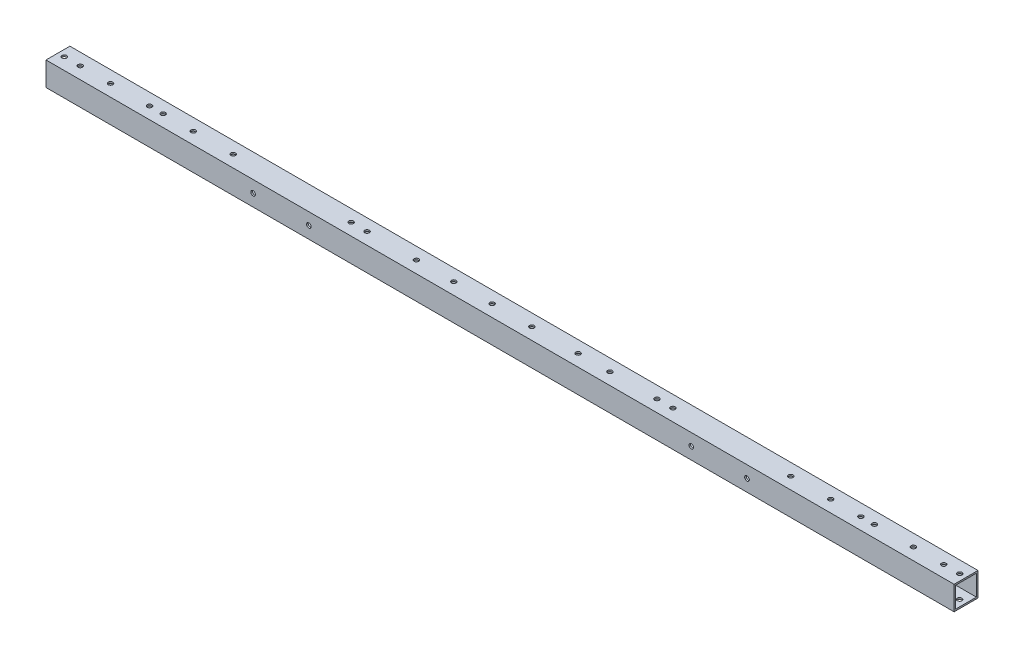
from build123d import *

# Parameters (mm, degrees)
SKETCH_1_W          = 15
SKETCH_1_H          = 15
SKETCH_1_W_2        = 13
SKETCH_1_H_2        = 13
EXTRUDE_1_DEPTH     = 570
SKETCH_2_R          = 1.45
CUT_EXTRUDE_1_DEPTH = 571.246657158
SKETCH_3_R          = 1.45
CUT_EXTRUDE_2_DEPTH = 571.246657158


with BuildPart() as part:
    # 草图1 → 凸台-拉伸1 (new body)
    with BuildSketch(Plane(origin=(0, 0, 0), x_dir=(0, 0, -1), z_dir=(1, 0, 0))):
        Rectangle(SKETCH_1_W, SKETCH_1_H)
        Rectangle(SKETCH_1_W_2, SKETCH_1_H_2, mode=Mode.SUBTRACT)
    extrude(amount=EXTRUDE_1_DEPTH)

    # 草图2 → 切除-拉伸1 (cut, through all)
    with BuildSketch(Plane(origin=(0, 7.5, 0), x_dir=(1, 0, 0), z_dir=(0, 1, 0))):
        with Locations(Location((566, 0, 0), (0, 0, 270))):
            Circle(SKETCH_2_R)
        with Locations(Location((556, 0, 0), (0, 0, 270))):
            Circle(SKETCH_2_R)
        with Locations(Location((485, 0, 0), (0, 0, 270))):
            Circle(SKETCH_2_R)
        with Locations(Location((460, 0, 0), (0, 0, 270))):
            Circle(SKETCH_2_R)
        with Locations(Location((297.5, 0, 0), (0, 0, 270))):
            Circle(SKETCH_2_R)
        with Locations(Location((272.5, 0, 0), (0, 0, 270))):
            Circle(SKETCH_2_R)
        with Locations(Location((110, 0, 0), (0, 0, 270))):
            Circle(SKETCH_2_R)
        with Locations(Location((85, 0, 0), (0, 0, 270))):
            Circle(SKETCH_2_R)
        with Locations(Location((14, 0, 0), (0, 0, 270))):
            Circle(SKETCH_2_R)
        with Locations(Location((4, 0, 0), (0, 0, 270))):
            Circle(SKETCH_2_R)
        with Locations(Location((512.5, 0, 0), (0, 0, 270))):
            Circle(SKETCH_2_R)
        with Locations(Location((57.5, 0, 0), (0, 0, 270))):
            Circle(SKETCH_2_R)
        with Locations(Location((504, 0, 0), (0, 0, 270))):
            Circle(SKETCH_2_R)
        with Locations(Location((537, 0, 0), (0, 0, 270))):
            Circle(SKETCH_2_R)
        with Locations(Location((66, 0, 0), (0, 0, 270))):
            Circle(SKETCH_2_R)
        with Locations(Location((33, 0, 0), (0, 0, 270))):
            Circle(SKETCH_2_R)
        with Locations(Location((225, 0, 0), (0, 0, 270))):
            Circle(SKETCH_2_R)
        with Locations(Location((346.5, 0, 0), (0, 0, 270))):
            Circle(SKETCH_2_R)
        with Locations(Location((326.5, 0, 0), (0, 0, 270))):
            Circle(SKETCH_2_R)
        with Locations(Location((248.5, 0, 0), (0, 0, 270))):
            Circle(SKETCH_2_R)
        with Locations(Location((184, 0, 0), (0, 0, 270))):
            Circle(SKETCH_2_R)
        with Locations(Location((194, 0, 0), (0, 0, 270))):
            Circle(SKETCH_2_R)
        with Locations(Location((376, 0, 0), (0, 0, 270))):
            Circle(SKETCH_2_R)
        with Locations(Location((386, 0, 0), (0, 0, 270))):
            Circle(SKETCH_2_R)
    extrude(amount=-CUT_EXTRUDE_1_DEPTH, mode=Mode.SUBTRACT)

    # 草图3 → 切除-拉伸2 (cut, through all)
    with BuildSketch(Plane(origin=(0, 0, -7.5), x_dir=(-1, 0, 0), z_dir=(0, 0, -1))):
        with Locations((-130, 0)):
            Circle(SKETCH_3_R)
        with Locations((-165, 0)):
            Circle(SKETCH_3_R)
        with Locations((-405, 0)):
            Circle(SKETCH_3_R)
        with Locations((-440, 0)):
            Circle(SKETCH_3_R)
    extrude(amount=-CUT_EXTRUDE_2_DEPTH, mode=Mode.SUBTRACT)


solid = part.part
